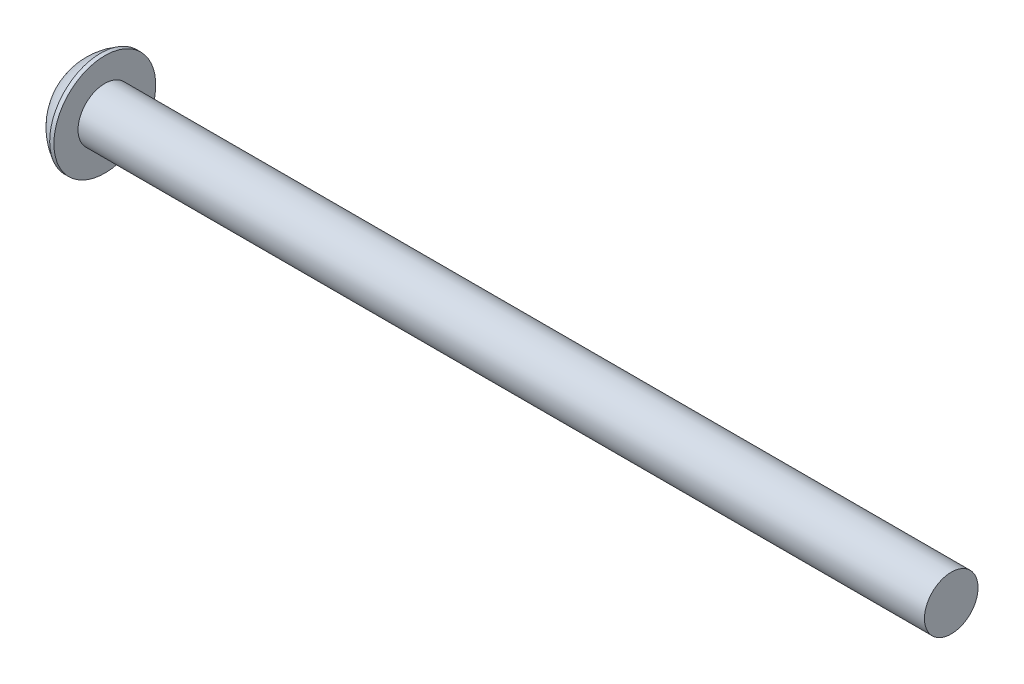
from build123d import *

# Parameters (mm, degrees)
CUT_EXTRUDE1_DEPTH = 1.8288


with BuildPart() as part:
    # Sketch1 → Revolve1 (revolve)
    with BuildSketch(Plane.XY, mode=Mode.PRIVATE) as revolve1_sk:
        with BuildLine():
            Line((0, 0), (76.9366, 0))
            Line((76.9366, 0), (76.9366, 2.413))
            Line((76.9366, 2.413), (0.7366, 2.413))
            Line((0.7366, 2.413), (0.7366, 4.5847))
            Line((0.7366, 4.5847), (0.3556, 4.5847))
            ThreePointArc((0.3556, 4.5847), (-0.901703741, 3.66491926), (-1.8288, 2.413))
            Line((-1.8288, 2.413), (-1.8288, 1.8288))
            Line((-1.8288, 1.8288), (0, 0))
        make_face()
    revolve(revolve1_sk.sketch.rotate(Axis((0, 0, 0), (1, 0, 0)), 90), axis=Axis((0, 0, 0), (1, 0, 0)))

    # Sketch2 → Cut-Extrude1 (cut)
    with BuildSketch(Plane.ZY.offset(1.8288)):
        Polygon((1.833087105, 0), (0.916543552, 1.5875), (-0.916543552, 1.5875), (-1.833087105, 0), (-0.916543552, -1.5875), (0.916543552, -1.5875), align=None)
    extrude(amount=-CUT_EXTRUDE1_DEPTH, mode=Mode.SUBTRACT)


solid = part.part
